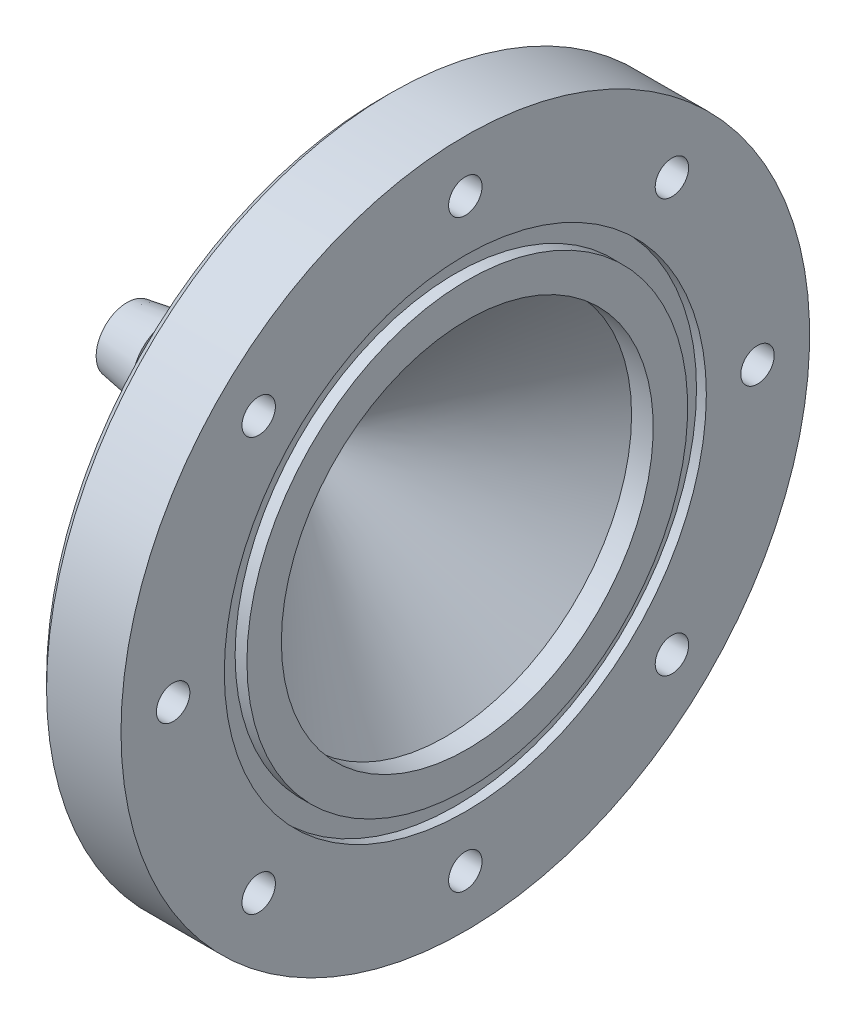
from build123d import *

# Parameters (mm, degrees)
SKETCH1_W                                           = 1.2
SKETCH1_H                                           = 3.5
CBORE_FOR_M3_HEX_SOCKET_HEAD_CAP_SCREW2_D           = 3.4
CBORE_FOR_M3_HEX_SOCKET_HEAD_CAP_SCREW2_DEPTH       = 8.566
CBORE_FOR_M3_HEX_SOCKET_HEAD_CAP_SCREW2_CBORE_D     = 6.5
CBORE_FOR_M3_HEX_SOCKET_HEAD_CAP_SCREW2_CBORE_DEPTH = 3.4
CBORE_FOR_M3_HEX_SOCKET_HEAD_CAP_SCREW2_TIP         = 1.021463052
CHAMFER1_SIZE                                       = 1


with BuildPart() as part:
    # Sketch1 → Revolve17 (revolve)
    with BuildSketch(Plane.XY, mode=Mode.PRIVATE) as revolve17_sk:
        Polygon((-13.572880732, 3.15), (-13.572880732, 3.85), (-17.906214066, 3.15), (-17.906214066, 1.9), (0, 1.9), (14.469928658, 18.9), (15.469928658, 18.9), (15.469928658, 22.4), (15.469928658, 24.5), (16.469928658, 24.5), (16.469928658, 35), (7.903928658, 35), (7.903928658, 18.9), (-4.906214066, 3.85), (-9.239547399, 3.15), (-9.239547399, 3.85), align=None)
        with Locations((16.069928658, 20.65)):
            Rectangle(SKETCH1_W, SKETCH1_H)
    revolve(revolve17_sk.sketch.rotate(Axis((-801.920554309, 0, 0), (1, 0, 0)), 90), axis=Axis((-801.920554309, 0, 0), (1, 0, 0)))

    # CBORE for M3 Hex Socket Head Cap Screw2
    with Locations(Plane.ZY.offset(-7.903928658)):
        with Locations((-21.001071401, -21.154915542), (0, 29.7), (29.7, 0), (-29.7, 0), (0, -29.7), (-21.001071401, 20.847227261), (21.001071401, 20.847227261), (21.001071401, -21.154915542)):
            CounterBoreHole(CBORE_FOR_M3_HEX_SOCKET_HEAD_CAP_SCREW2_D / 2, CBORE_FOR_M3_HEX_SOCKET_HEAD_CAP_SCREW2_CBORE_D / 2, CBORE_FOR_M3_HEX_SOCKET_HEAD_CAP_SCREW2_CBORE_DEPTH, depth=CBORE_FOR_M3_HEX_SOCKET_HEAD_CAP_SCREW2_DEPTH)
            with Locations((0, 0, -(CBORE_FOR_M3_HEX_SOCKET_HEAD_CAP_SCREW2_DEPTH + CBORE_FOR_M3_HEX_SOCKET_HEAD_CAP_SCREW2_TIP / 2))):  # 118° drill point
                Cone(0, CBORE_FOR_M3_HEX_SOCKET_HEAD_CAP_SCREW2_D / 2, CBORE_FOR_M3_HEX_SOCKET_HEAD_CAP_SCREW2_TIP, mode=Mode.SUBTRACT)

    # Chamfer1
    chamfer1_edges = [part.edges().sort_by_distance(p)[0] for p in [
        (7.903928658, 0, -35),
    ]]
    chamfer(chamfer1_edges, length=CHAMFER1_SIZE)


solid = part.part
